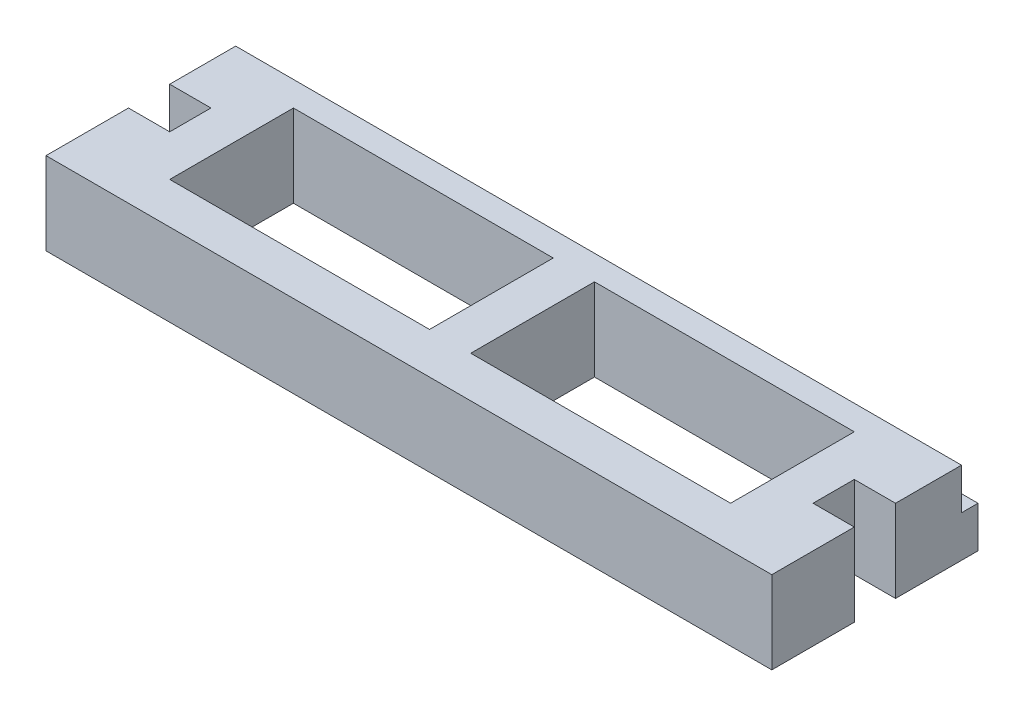
from build123d import *

# Parameters (mm, degrees)
SKETCH1_W           = 98
SKETCH1_H           = 25
BOSS_EXTRUDE1_DEPTH = 10
CUT_EXTRUDE4_DEPTH  = 10
SKETCH4_W           = 25
SKETCH4_H           = 10
CUT_EXTRUDE6_DEPTH  = 5
SKETCH5_W           = 25
SKETCH5_H           = 10
CUT_EXTRUDE7_DEPTH  = 5
SKETCH6_W           = 5
SKETCH6_H           = 10
CUT_EXTRUDE8_DEPTH  = 5
SKETCH7_W           = 5
SKETCH7_H           = 10
CUT_EXTRUDE9_DEPTH  = 5
SKETCH8_W           = 88
SKETCH8_H           = 5
CUT_EXTRUDE10_DEPTH = 2


with BuildPart() as part:
    # Sketch1 → Boss-Extrude1 (new body)
    with BuildSketch(Plane(origin=(0, 0, 0), x_dir=(1, 0, 0), z_dir=(0, 1, 0))):
        Rectangle(SKETCH1_W, SKETCH1_H)
    extrude(amount=BOSS_EXTRUDE1_DEPTH)

    # Sketch2 → Cut-Extrude4 (cut)
    with BuildSketch(Plane(origin=(0, 10, 0), x_dir=(1, 0, 0), z_dir=(0, 1, 0))):
        Polygon((-2.5, 2.403992328), (-2.5, -7.5), (-34, -7.5), (-34, 7.5), (-2.5, 7.5), align=None)
        Polygon((2.5, 2.403992328), (2.5, 7.5), (34, 7.5), (34, -7.5), (2.5, -7.5), align=None)
    extrude(amount=-CUT_EXTRUDE4_DEPTH, mode=Mode.SUBTRACT)

    # Sketch4 → Cut-Extrude6 (cut)
    with BuildSketch(Plane.ZY.offset(49)):
        with Locations((0, 5)):
            Rectangle(SKETCH4_W, SKETCH4_H)
    extrude(amount=-CUT_EXTRUDE6_DEPTH, mode=Mode.SUBTRACT)

    # Sketch5 → Cut-Extrude7 (cut)
    with BuildSketch(Plane(origin=(49, 0, 0), x_dir=(0, 0, -1), z_dir=(1, 0, 0))):
        with Locations((0, 5)):
            Rectangle(SKETCH5_W, SKETCH5_H)
    extrude(amount=-CUT_EXTRUDE7_DEPTH, mode=Mode.SUBTRACT)

    # Sketch6 → Cut-Extrude8 (cut)
    with BuildSketch(Plane(origin=(44, 0, 0), x_dir=(0, 0, -1), z_dir=(1, 0, 0))):
        with Locations((0, 5)):
            Rectangle(SKETCH6_W, SKETCH6_H)
    extrude(amount=-CUT_EXTRUDE8_DEPTH, mode=Mode.SUBTRACT)

    # Sketch7 → Cut-Extrude9 (cut)
    with BuildSketch(Plane.ZY.offset(44)):
        with Locations((0, 5)):
            Rectangle(SKETCH7_W, SKETCH7_H)
    extrude(amount=-CUT_EXTRUDE9_DEPTH, mode=Mode.SUBTRACT)

    # Sketch8 → Cut-Extrude10 (cut)
    with BuildSketch(Plane(origin=(0, 0, -12.5), x_dir=(-1, 0, 0), z_dir=(0, 0, -1))):
        with Locations((0, 7.5)):
            Rectangle(SKETCH8_W, SKETCH8_H)
    extrude(amount=-CUT_EXTRUDE10_DEPTH, mode=Mode.SUBTRACT)


solid = part.part
